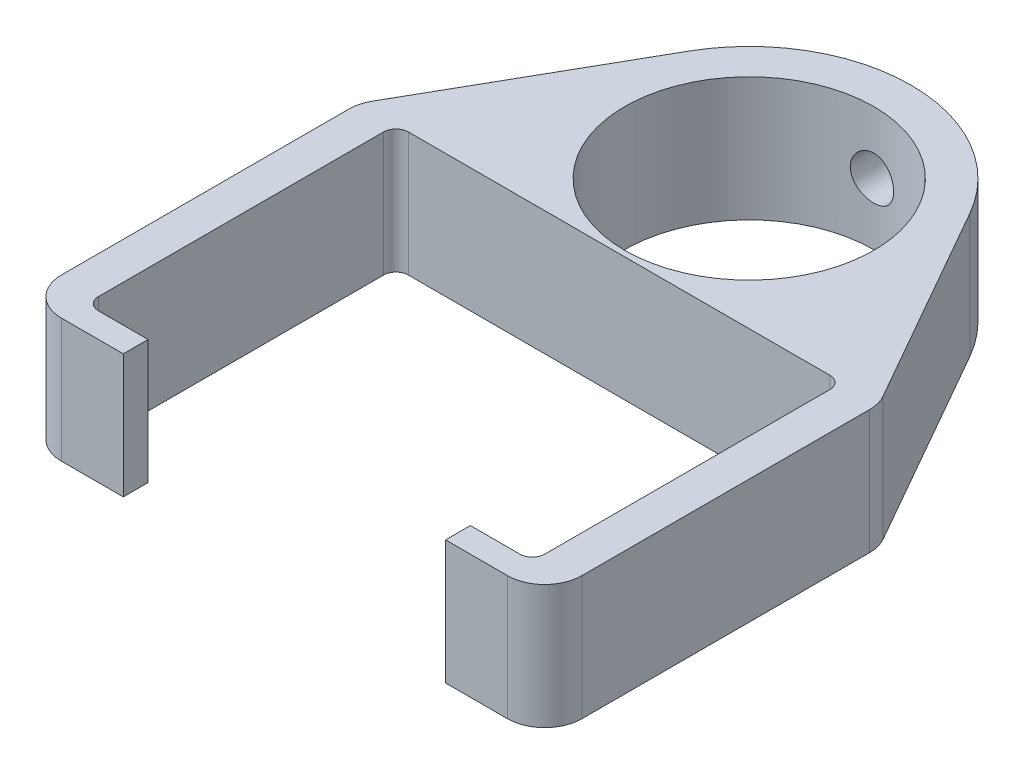
from build123d import *

# Parameters (mm, degrees)
SKETCH_1_R          = 10.05
EXTRUDE_1_DEPTH     = 10
FILLET_1_R          = 3
FILLET_2_R          = 1
SKETCH_2_R          = 1.75
CUT_EXTRUDE_1_DEPTH = 45.127655727


with BuildPart() as part:
    # 草图1 → 凸台-拉伸1 (new body)
    with BuildSketch(Plane(origin=(0, 0, 0), x_dir=(1, 0, 0), z_dir=(0, 1, 0))):
        with BuildLine():
            Line((-11.33930071, 6.459315707), (-21, -10.5))
            Line((-21, -10.5), (-21, -37.5))
            Line((-21, -37.5), (-13, -37.5))
            Line((-13, -37.5), (-13, -35.5))
            Line((-13, -35.5), (-18, -35.5))
            Line((-18, -35.5), (-18, -10.5))
            Line((-18, -10.5), (18, -10.5))
            Line((18, -10.5), (18, -35.5))
            Line((18, -35.5), (13, -35.5))
            Line((13, -35.5), (13, -37.5))
            Line((13, -37.5), (21, -37.5))
            Line((21, -37.5), (21, -10.5))
            Line((21, -10.5), (11.33930071, 6.459315707))
            ThreePointArc((11.33930071, 6.459315707), (0, 13.05), (-11.33930071, 6.459315707))
        make_face()
        with Locations(Location((0, 0, 0), (0, 0, 270))):
            Circle(SKETCH_1_R, mode=Mode.SUBTRACT)
    extrude(amount=EXTRUDE_1_DEPTH)

    # 圆角1
    fillet_1_edges = [part.edges().sort_by_distance(p)[0] for p in [
        (21, 5, 37.5),
        (-21, 5, 37.5),
        (-21, 5, 10.5),
        (21, 5, 10.5),
    ]]
    fillet(fillet_1_edges, radius=FILLET_1_R)

    # 圆角2
    fillet_2_edges = [part.edges().sort_by_distance(p)[0] for p in [
        (18, 5, 10.5),
        (-18, 5, 10.5),
        (-18, 5, 35.5),
        (18, 5, 35.5),
    ]]
    fillet(fillet_2_edges, radius=FILLET_2_R)

    # 草图2 → 切除-拉伸1 (cut, through all)
    with BuildSketch(Plane.XY):
        with Locations(Location((0, 5, 0), (0, 0, 90))):
            Circle(SKETCH_2_R)
    extrude(amount=-CUT_EXTRUDE_1_DEPTH, mode=Mode.SUBTRACT)


solid = part.part
